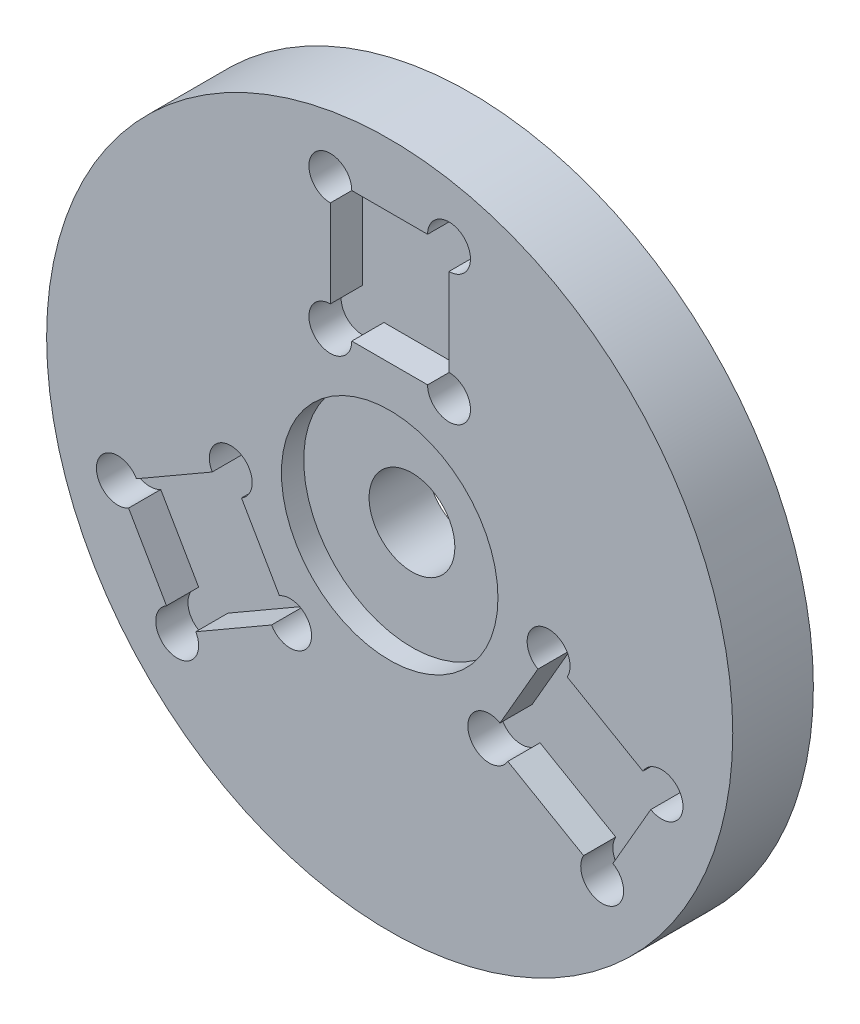
from build123d import *

# Parameters (mm, degrees)
SKETCH1_R                = 50.8
BASEPLATE_DEPTH          = 11.938
SKETCH3_R                = 16.03375
MAGNET_INSET_DEPTH       = 3.302
SKETCH4_W                = 17.575320152
SKETCH4_H                = 19.304
DOWEL_SLOT_DEPTH         = 4.7625
SKETCH6_R                = 3.175
DOWEL_SLOT_RELIEFS_DEPTH = 4.7625
DOWEL_SLOT_PATTERN_COUNT = 3
SKETCH7_R                = 6.35
CENTRAL_HOLE_DEPTH       = 73.82716419


with BuildPart() as part:
    # Sketch1 → baseplate (new body)
    with BuildSketch(Plane.XY):
        Circle(SKETCH1_R)
    extrude(amount=BASEPLATE_DEPTH)

    # Sketch3 → magnet_inset (cut)
    with BuildSketch(Plane.XY.offset(11.938)):
        Circle(SKETCH3_R)
    extrude(amount=-MAGNET_INSET_DEPTH, mode=Mode.SUBTRACT)

    # Sketch4 → dowel_slot (cut)
    with BuildSketch(Plane.XY.offset(11.938)):
        with Locations((0, 31.75)):
            Rectangle(SKETCH4_W, SKETCH4_H)
    dowel_slot = extrude(amount=-DOWEL_SLOT_DEPTH, mode=Mode.SUBTRACT)

    # Sketch6 → dowel_slot_reliefs (cut)
    with BuildSketch(Plane.XY.offset(11.938)):
        with Locations((-8.787660076, 41.402)):
            Circle(SKETCH6_R)
        with Locations((8.787660076, 41.402)):
            Circle(SKETCH6_R)
        with Locations((8.787660076, 22.098)):
            Circle(SKETCH6_R)
        with Locations((-8.787660076, 22.098)):
            Circle(SKETCH6_R)
    dowel_slot_reliefs = extrude(amount=-DOWEL_SLOT_RELIEFS_DEPTH, mode=Mode.SUBTRACT)

    # dowel_slot_pattern: dowel_slot, dowel_slot_reliefs ×3 about axis
    dowel_slot_pattern_axis = Axis((0, 0, 0), (0, 0, 1))
    add([dowel_slot.rotate(dowel_slot_pattern_axis, i * 360 / DOWEL_SLOT_PATTERN_COUNT) for i in range(1, DOWEL_SLOT_PATTERN_COUNT)], mode=Mode.SUBTRACT)
    add([dowel_slot_reliefs.rotate(dowel_slot_pattern_axis, i * 360 / DOWEL_SLOT_PATTERN_COUNT) for i in range(1, DOWEL_SLOT_PATTERN_COUNT)], mode=Mode.SUBTRACT)

    # Sketch7 → central_hole (cut, through all)
    with BuildSketch(Plane.XY.offset(11.938)):
        Circle(SKETCH7_R)
    extrude(amount=-CENTRAL_HOLE_DEPTH, mode=Mode.SUBTRACT)


solid = part.part
